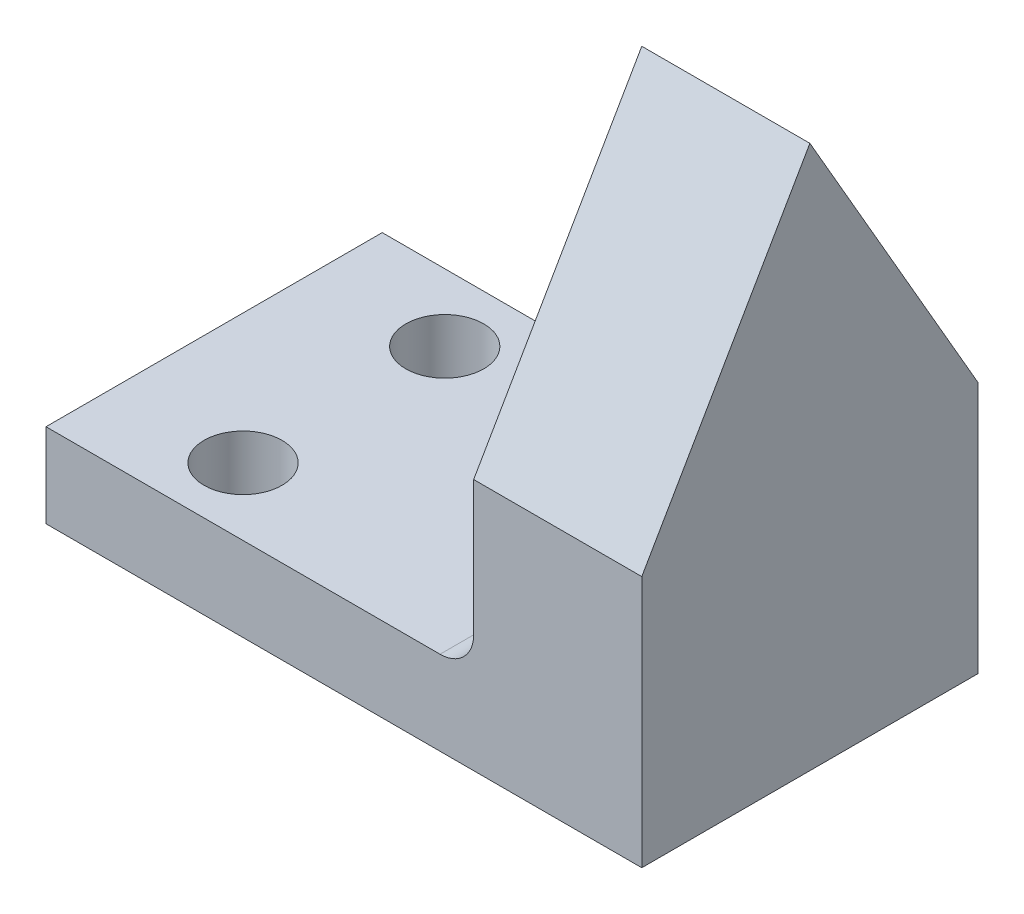
from build123d import *

# Parameters (mm, degrees)
SKETCH1_W           = 3.4544
SKETCH1_H           = 12.7
SKETCH1_R           = 1.4732
SKETCH1_W_2         = 15.875
BOSS_EXTRUDE1_DEPTH = 3.175
SKETCH2_W           = 12.7
SKETCH2_H           = 6.35
BOSS_EXTRUDE2_DEPTH = 6.35
SKETCH3_W           = 12.7
SKETCH3_H           = 3.175
BOSS_EXTRUDE3_DEPTH = 3.175
FILLET1_R           = 1.27


with BuildPart() as part:
    # Sketch1 → Boss-Extrude1 (new body)
    # profile 1 of 2: a face of its own
    with BuildSketch(Plane(origin=(0, 0, 0), x_dir=(1, 0, 0), z_dir=(0, 1, 0))):
        with Locations((-9.6647, 0)):
            Rectangle(SKETCH1_W, SKETCH1_H)
        with Locations(Location((-9.6647, -3.81, 0), (0, 0, 270))):
            Circle(SKETCH1_R, mode=Mode.SUBTRACT)
        with Locations(Location((-9.6647, 3.81, 0), (0, 0, 270))):
            Circle(SKETCH1_R, mode=Mode.SUBTRACT)
    # profile 2 of 2: a face of its own
    with BuildSketch(Plane(origin=(0, 0, 0), x_dir=(1, 0, 0), z_dir=(0, 1, 0))):
        Rectangle(SKETCH1_W_2, SKETCH1_H)
    extrude(amount=BOSS_EXTRUDE1_DEPTH)

    # Sketch2 → Boss-Extrude2 (add)
    with BuildSketch(Plane(origin=(7.9375, 0, 0), x_dir=(0, 0, -1), z_dir=(1, 0, 0))):
        with Locations((0, 6.35)):
            Rectangle(SKETCH2_W, SKETCH2_H)
        Polygon((0, 20.523522628), (6.35, 9.525), (-6.35, 9.525), align=None)
    extrude(amount=-BOSS_EXTRUDE2_DEPTH)

    # Sketch3 → Boss-Extrude3 (add)
    with BuildSketch(Plane.ZY.offset(11.3919)):
        with Locations((0, 1.5875)):
            Rectangle(SKETCH3_W, SKETCH3_H)
    extrude(amount=BOSS_EXTRUDE3_DEPTH)

    # Fillet1
    fillet1_edges = [part.edges().sort_by_distance(p)[0] for p in [
        (1.5875, 3.175, 0),
    ]]
    fillet(fillet1_edges, radius=FILLET1_R)


solid = part.part
